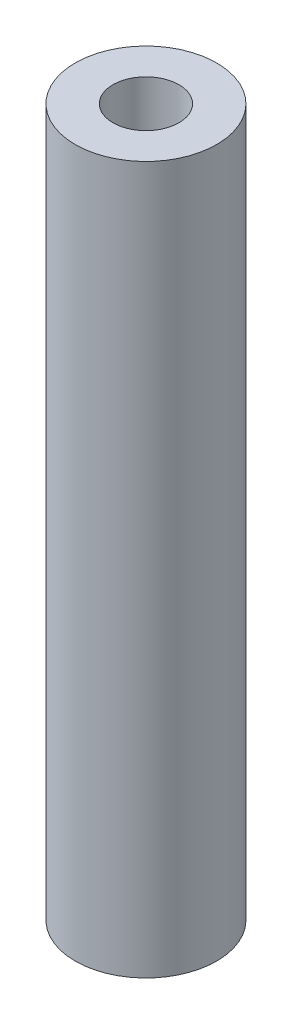
from build123d import *

# Parameters (mm, degrees)
SKETCH1_R       = 3
SKETCH1_R_2     = 1.4
EXTRUSION_DEPTH = 30


with BuildPart() as part:
    # Sketch1 → Extrusion (new body)
    with BuildSketch(Plane(origin=(0, 0, 0), x_dir=(1, 0, 0), z_dir=(0, 1, 0))):
        with Locations(Location((0, 0, 0), (0, 0, 270))):
            Circle(SKETCH1_R)
        with Locations(Location((0, 0, 0), (0, 0, 270))):
            Circle(SKETCH1_R_2, mode=Mode.SUBTRACT)
    extrude(amount=EXTRUSION_DEPTH)


solid = part.part
